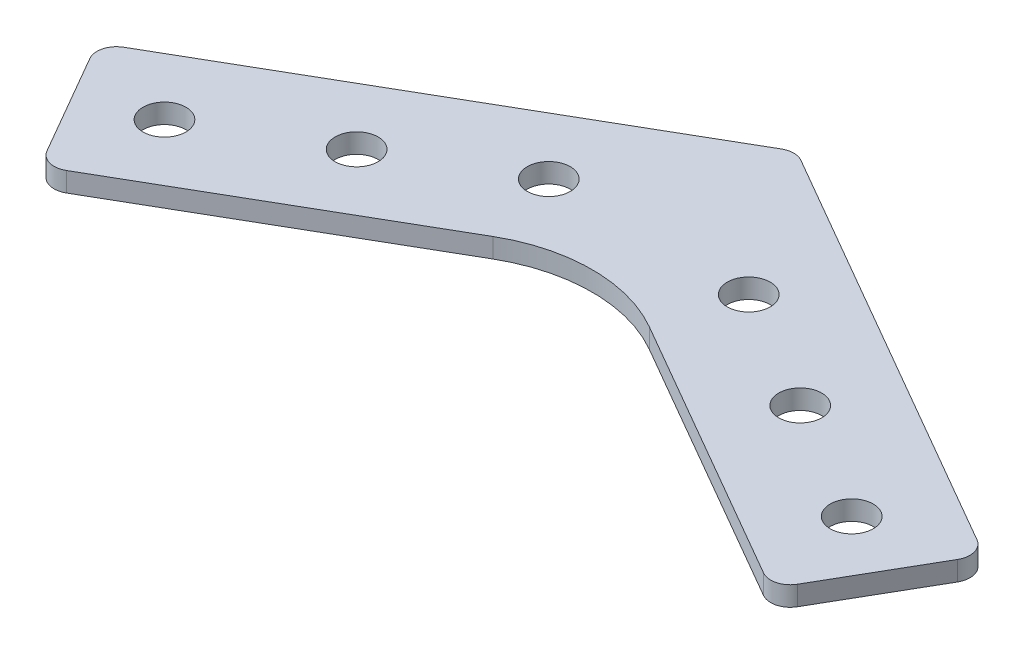
from build123d import *

# Parameters (mm, degrees)
BOSS_EXTRUDE1_DEPTH = 3.175
SKETCH2_R           = 3.4925
CUT_EXTRUDE2_DEPTH  = 3.175
LPATTERN5_COUNT     = 3
LPATTERN5_PITCH     = 22.86
SKETCH7_R           = 3.4925
CUT_EXTRUDE3_DEPTH  = 3.175
LPATTERN6_COUNT     = 3
LPATTERN6_PITCH     = 22.86
FILLET1_R           = 3.175
FILLET2_R           = 25.4
FILLET3_R           = 3.175


with BuildPart() as part:
    # Sketch1 → Boss-Extrude1 (new body)
    with BuildSketch(Plane(origin=(0, 0, 0), x_dir=(1, 0, 0), z_dir=(0, 1, 0))):
        Polygon((-25.4, 14.664696837), (0, 29.329393675), (25.4, 14.664696837), (72.092022192, -12.292954744), (59.392022192, -34.29), (0, 0), (-59.392022192, -34.29), (-72.092022192, -12.292954744), align=None)
    extrude(amount=BOSS_EXTRUDE1_DEPTH)

    # Sketch2 → Cut-Extrude2 (cut)
    with BuildSketch(Plane(origin=(0, 3.175, 0), x_dir=(1, 0, 0), z_dir=(0, 1, 0))):
        with Locations((-55.843351826, -17.576477372)):
            Circle(SKETCH2_R)
    cut_extrude2 = extrude(amount=-CUT_EXTRUDE2_DEPTH, mode=Mode.SUBTRACT)

    # LPattern5: Cut-Extrude2 ×3
    with Locations(*[Vector(0.8660254037844386, 0, -0.5000000000000002) * (i * LPATTERN5_PITCH) for i in range(1, LPATTERN5_COUNT)]):
        add(cut_extrude2, mode=Mode.SUBTRACT)

    # Sketch7 → Cut-Extrude3 (cut)
    with BuildSketch(Plane(origin=(0, 3.175, 0), x_dir=(1, 0, 0), z_dir=(0, 1, 0))):
        with Locations((55.843351826, -17.576477372)):
            Circle(SKETCH7_R)
    cut_extrude3 = extrude(amount=-CUT_EXTRUDE3_DEPTH, mode=Mode.SUBTRACT)

    # LPattern6: Cut-Extrude3 ×3
    with Locations(*[Vector(-0.8660254037844377, 0, -0.5000000000000018) * (i * LPATTERN6_PITCH) for i in range(1, LPATTERN6_COUNT)]):
        add(cut_extrude3, mode=Mode.SUBTRACT)

    # Fillet1
    fillet1_edges = [part.edges().sort_by_distance(p)[0] for p in [
        (-72.092022192, 1.5875, 12.292954744),
        (-59.392022192, 1.5875, 34.29),
        (72.092022192, 1.5875, 12.292954744),
        (59.392022192, 1.5875, 34.29),
    ]]
    fillet(fillet1_edges, radius=FILLET1_R)

    # Fillet2
    fillet2_edges = [part.edges().sort_by_distance(p)[0] for p in [
        (0, 1.5875, 0),
    ]]
    fillet(fillet2_edges, radius=FILLET2_R)

    # Fillet3
    fillet3_edges = [part.edges().sort_by_distance(p)[0] for p in [
        (0, 1.5875, -29.329393675),
    ]]
    fillet(fillet3_edges, radius=FILLET3_R)


solid = part.part
